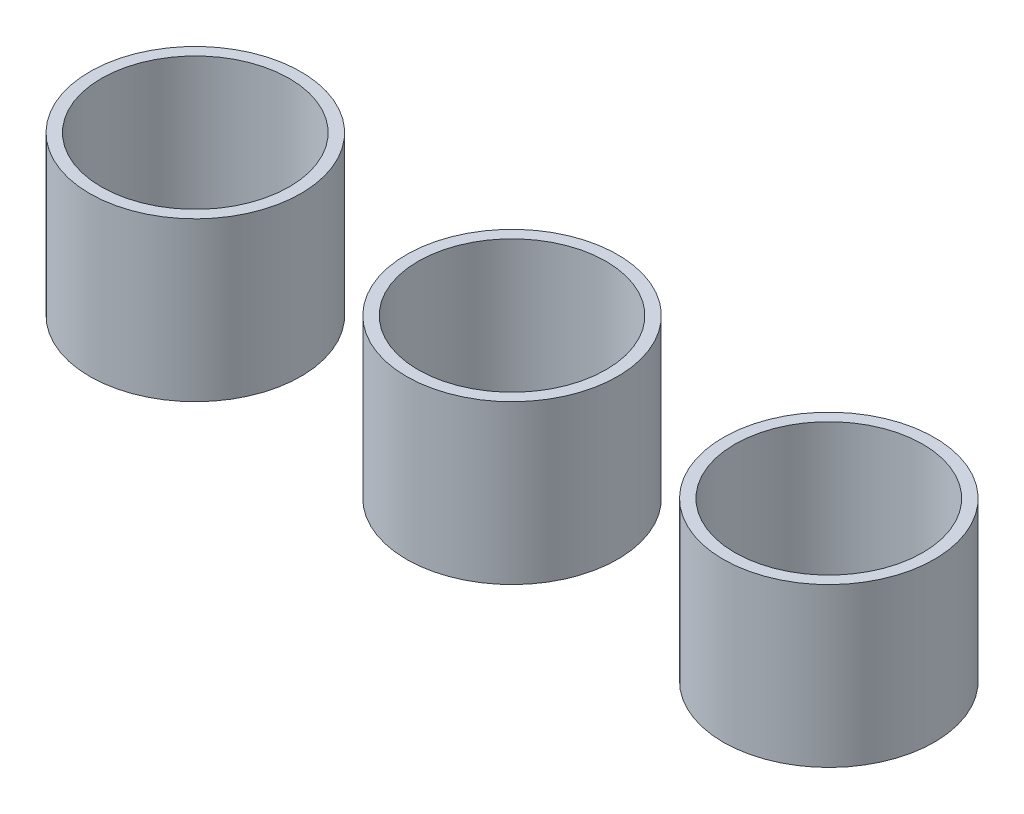
from build123d import *

# Parameters (mm, degrees)
SKETCH_1_R        = 10
SKETCH_1_R_2      = 8.9
EXTRUDE_1_DEPTH   = 15
EXTRUDE_1_2_DEPTH = 15
EXTRUDE_1_3_DEPTH = 15


with BuildPart() as part:
    # 草图1 → 拉伸-薄壁1 (new body)
    with BuildSketch(Plane(origin=(0, 0, 0), x_dir=(1, 0, 0), z_dir=(0, 1, 0))):
        Circle(SKETCH_1_R)
        Circle(SKETCH_1_R_2, mode=Mode.SUBTRACT)
    extrude(amount=EXTRUDE_1_DEPTH)


with BuildPart() as body_2:
    # 草图1 → Extrude 1 2 (new body)
    with BuildSketch(Plane(origin=(0, 0, 0), x_dir=(1, 0, 0), z_dir=(0, 1, 0))):
        with Locations((30, 0)):
            Circle(SKETCH_1_R)
        with Locations((30, 0)):
            Circle(SKETCH_1_R_2, mode=Mode.SUBTRACT)
    extrude(amount=EXTRUDE_1_2_DEPTH)


with BuildPart() as body_3:
    # 草图1 → Extrude 1 3 (new body)
    with BuildSketch(Plane(origin=(0, 0, 0), x_dir=(1, 0, 0), z_dir=(0, 1, 0))):
        with Locations((60, 0)):
            Circle(SKETCH_1_R)
        with Locations((60, 0)):
            Circle(SKETCH_1_R_2, mode=Mode.SUBTRACT)
    extrude(amount=EXTRUDE_1_3_DEPTH)


solid = Compound([part.part, body_2.part, body_3.part])
